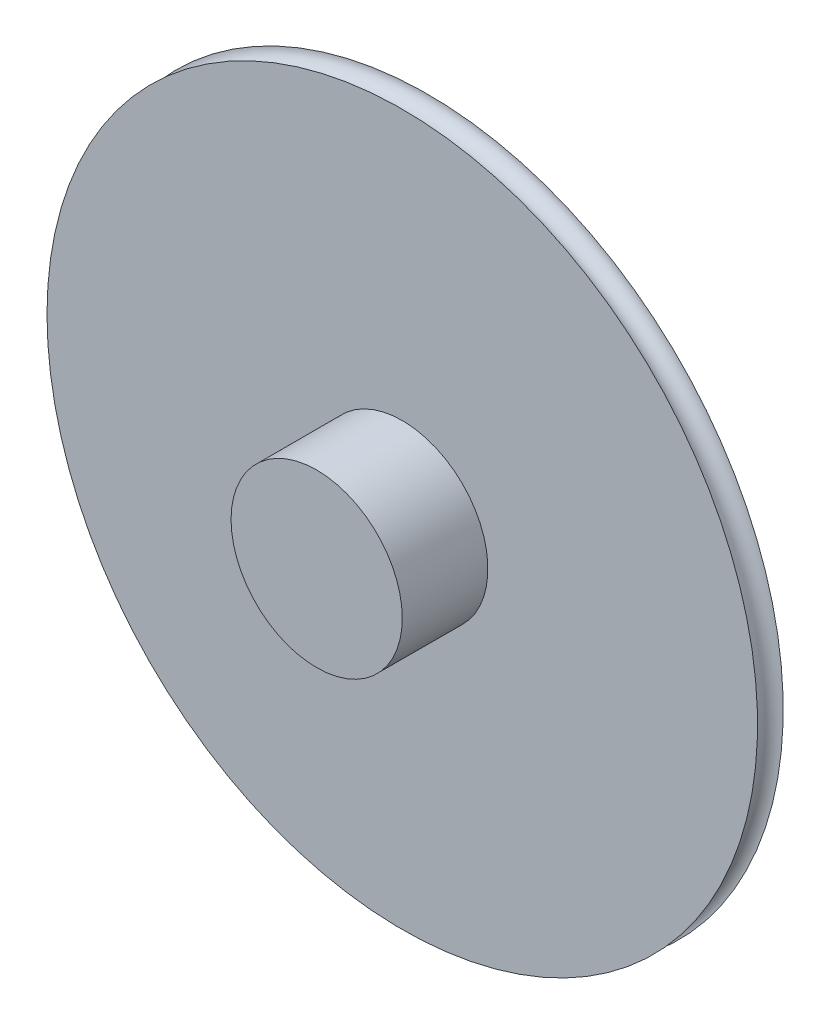
from build123d import *

# Parameters (mm, degrees)
SKETCH2_R           = 10
BOSS_EXTRUDE1_DEPTH = 10


with BuildPart() as part:
    # Sketch1 → Revolve2 (revolve)
    with BuildSketch(Plane(origin=(0, 0, 0), x_dir=(1, 0, 0), z_dir=(0, 1, 0)), mode=Mode.PRIVATE) as revolve2_sk:
        with BuildLine():
            Line((40, 1.5), (41.5, 1.5))
            ThreePointArc((41.5, 1.5), (40, 0), (41.5, -1.5))
            Line((41.5, -1.5), (40, -1.5))
            Line((40, -1.5), (0, -1.5))
            Line((0, -1.5), (0, 1.5))
            Line((0, 1.5), (40, 1.5))
        make_face()
    revolve(revolve2_sk.sketch.rotate(Axis((0, 0, -1.5), (0, 0, 1)), 180), axis=Axis((0, 0, -1.5), (0, 0, 1)))

    # Sketch2 → Boss-Extrude1 (add)
    with BuildSketch(Plane.XY.offset(1.5)):
        with Locations(Location((0, 0, 0), (0, 0, 180))):
            Circle(SKETCH2_R)
    extrude(amount=BOSS_EXTRUDE1_DEPTH)


solid = part.part
